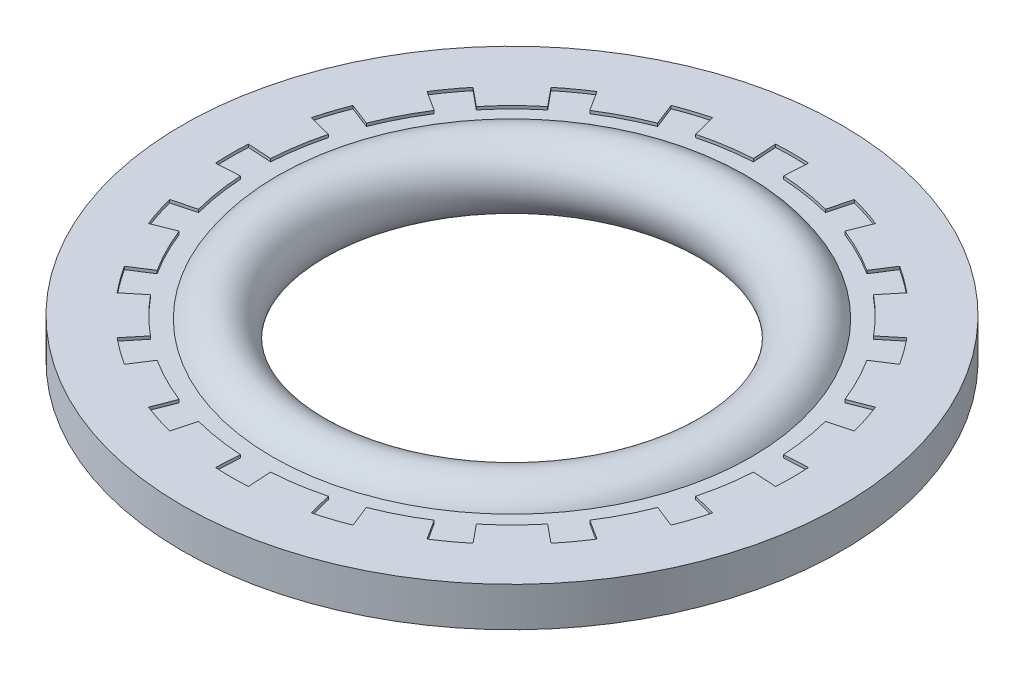
from build123d import *

# Parameters (mm, degrees)
SKETCH2_W          = 1.8759424
SKETCH2_H          = 1.016
CUT_EXTRUDE1_DEPTH = 13.076357812
CIRPATTERN1_COUNT  = 20


with BuildPart() as part:
    # Sketch2 → Revolve1 (revolve)
    with BuildSketch(Plane.XY, mode=Mode.PRIVATE) as revolve1_sk:
        with Locations((-7.5710288, 0)):
            Rectangle(SKETCH2_W, SKETCH2_H)
    revolve(revolve1_sk.sketch.rotate(Axis((0, 0, 0), (0, 1, 0)), 270), axis=Axis((0, 0, 0), (0, 1, 0)))

    # Sketch3 → Cut-Extrude1 (cut, through all)
    with BuildSketch(Plane(origin=(0, 0.508, 0), x_dir=(1, 0, 0), z_dir=(0, 1, 0))):
        with BuildLine():
            Line((-0.389564217, 6.621608026), (-0.42545, 7.231575717))
            ThreePointArc((-0.42545, 7.231575717), (0, 7.24408), (0.42545, 7.231575717))
            Line((0.42545, 7.231575717), (0.389564217, 6.621608026))
            ThreePointArc((0.389564217, 6.621608026), (0, 6.6330576), (-0.389564217, 6.621608026))
        make_face()
    cut_extrude1 = extrude(amount=-CUT_EXTRUDE1_DEPTH, mode=Mode.SUBTRACT)

    # CirPattern1: Cut-Extrude1 ×20 about axis
    cirpattern1_axis = Axis((0, 0, 0), (0, 1, 0))
    for i in range(1, CIRPATTERN1_COUNT):
        add(cut_extrude1.rotate(cirpattern1_axis, i * 360 / CIRPATTERN1_COUNT), mode=Mode.SUBTRACT)

    # Sketch4 → Revolve2 (revolve)
    with BuildSketch(Plane.XY, mode=Mode.PRIVATE) as revolve2_sk:
        with BuildLine():
            Line((-7.24408, -0.4318), (-6.183499539, -0.4318))
            ThreePointArc((-6.183499539, -0.4318), (-4.572, 0), (-6.183499539, 0.4318))
            Line((-6.183499539, 0.4318), (-7.24408, 0.4318))
            Line((-7.24408, 0.4318), (-7.24408, -0.4318))
        make_face()
    revolve(revolve2_sk.sketch.rotate(Axis((0, 0, 0), (0, 1, 0)), 270), axis=Axis((0, 0, 0), (0, 1, 0)))


solid = part.part
